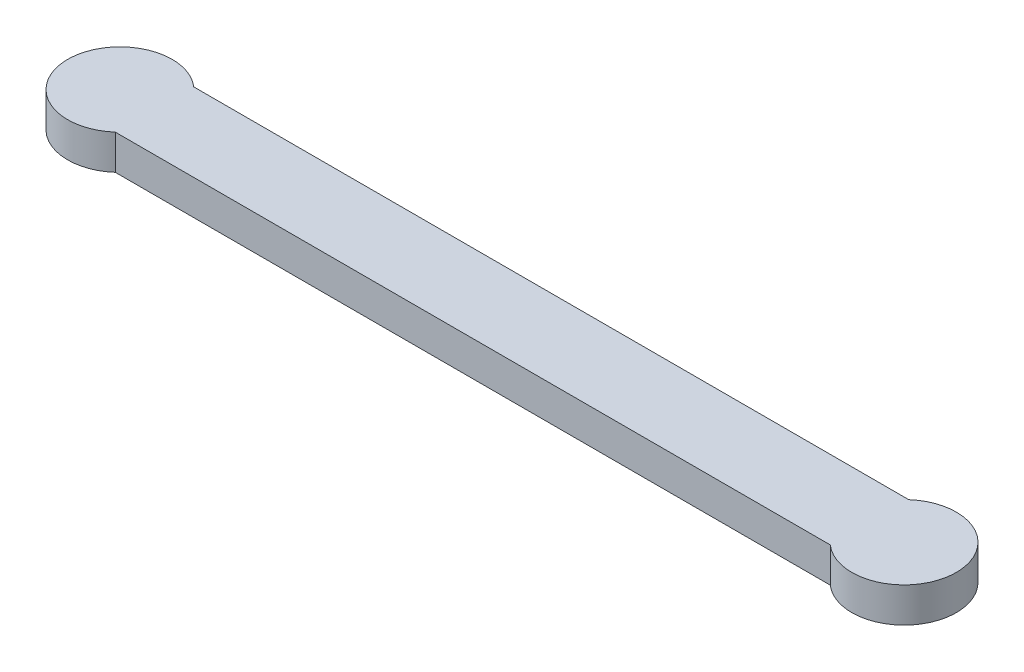
from build123d import *

# Parameters (mm, degrees)
SKETCH_1_R      = 6
EXTRUDE_1_DEPTH = 4


with BuildPart() as part:
    # 草图1 → 凸台-拉伸1 (new body)
    with BuildSketch(Plane(origin=(0, 0, 0), x_dir=(1, 0, 0), z_dir=(0, 1, 0))):
        Circle(SKETCH_1_R)
        with Locations((90, 0)):
            Circle(SKETCH_1_R)
        with BuildLine():
            Line((0, 4.5), (90, 4.5))
            ThreePointArc((90, 4.5), (94.5, 0), (90, -4.5))
            Line((90, -4.5), (0, -4.5))
            ThreePointArc((0, -4.5), (-4.5, 0), (0, 4.5))
        make_face()
    extrude(amount=EXTRUDE_1_DEPTH)


solid = part.part
